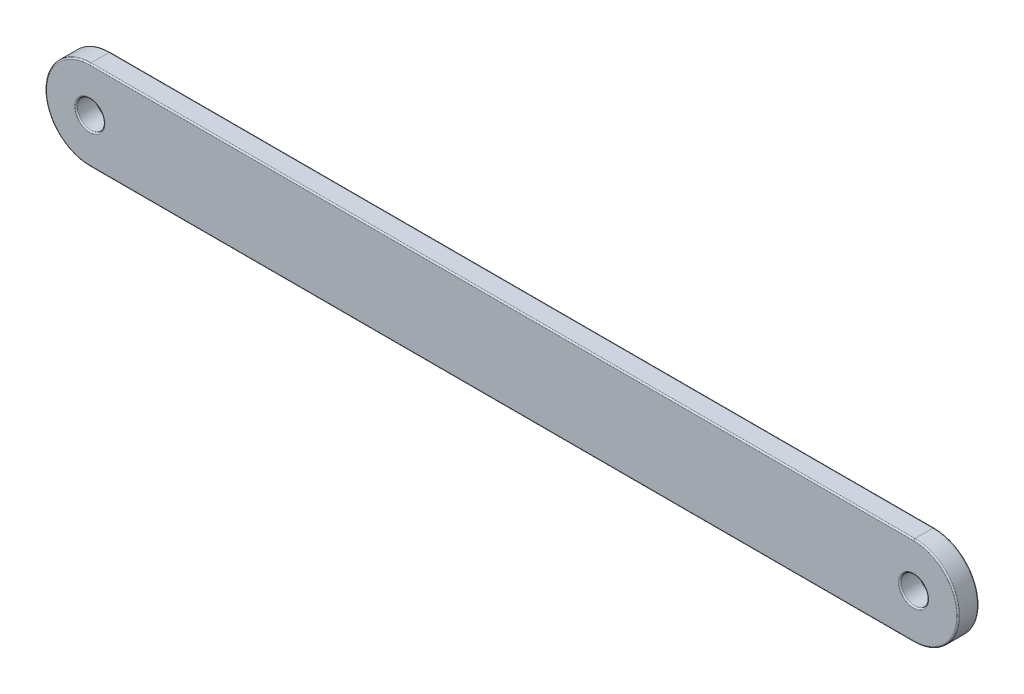
from build123d import *

# Parameters (mm, degrees)
SKETCH1_R           = 1
BOSS_EXTRUDE1_DEPTH = 0.75
FILLET1_R           = 0.1


with BuildPart() as part:
    # Sketch1 → Boss-Extrude1 (new, symmetric)
    with BuildSketch(Plane.XY):
        with BuildLine():
            Line((-30, 3.25), (30, 3.25))
            ThreePointArc((30, 3.25), (33.25, 0), (30, -3.25))
            Line((30, -3.25), (-30, -3.25))
            ThreePointArc((-30, -3.25), (-33.25, 0), (-30, 3.25))
        make_face()
        with Locations((-30, 0)):
            Circle(SKETCH1_R, mode=Mode.SUBTRACT)
        with Locations((30, 0)):
            Circle(SKETCH1_R, mode=Mode.SUBTRACT)
    extrude(amount=BOSS_EXTRUDE1_DEPTH, both=True)

    # Fillet1
    fillet1_edges = [part.edges().sort_by_distance(p)[0] for p in [
        (-31, 0, -0.75),
        (-31, 0, 0.75),
        (33.25, 0, 0.75),
        (29, 0, -0.75),
        (29, 0, 0.75),
        (0, 3.25, 0.75),
        (-33.25, 0, 0.75),
        (0, 3.25, -0.75),
        (33.25, 0, -0.75),
        (0, -3.25, -0.75),
        (-33.25, 0, -0.75),
        (0, -3.25, 0.75),
    ]]
    fillet(fillet1_edges, radius=FILLET1_R)


solid = part.part
